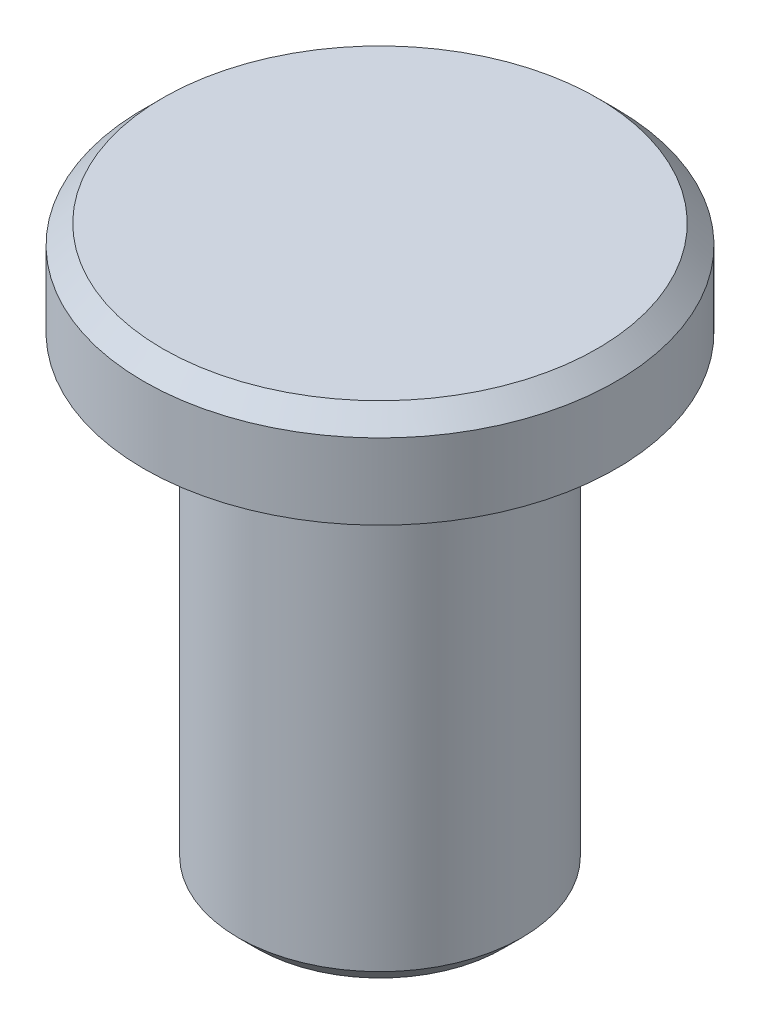
from build123d import *

# Parameters (mm, degrees)
CHAMFER1_SIZE = 0.2


with BuildPart() as part:
    # Sketch1 → Revolve1 (revolve)
    with BuildSketch(Plane.XY, mode=Mode.PRIVATE) as revolve1_sk:
        Polygon((0, 0), (0, 6), (2.5, 6), (2.5, 5), (1.5, 5), (1.5, 0), align=None)
    revolve(revolve1_sk.sketch.rotate(Axis((0, 0, 0), (0, 1, 0)), 90), axis=Axis((0, 0, 0), (0, 1, 0)))

    # Chamfer1
    chamfer1_edges = [part.edges().sort_by_distance(p)[0] for p in [
        (0, 0, 1.5),
        (0, 6, 2.5),
    ]]
    chamfer(chamfer1_edges, length=CHAMFER1_SIZE)


solid = part.part
